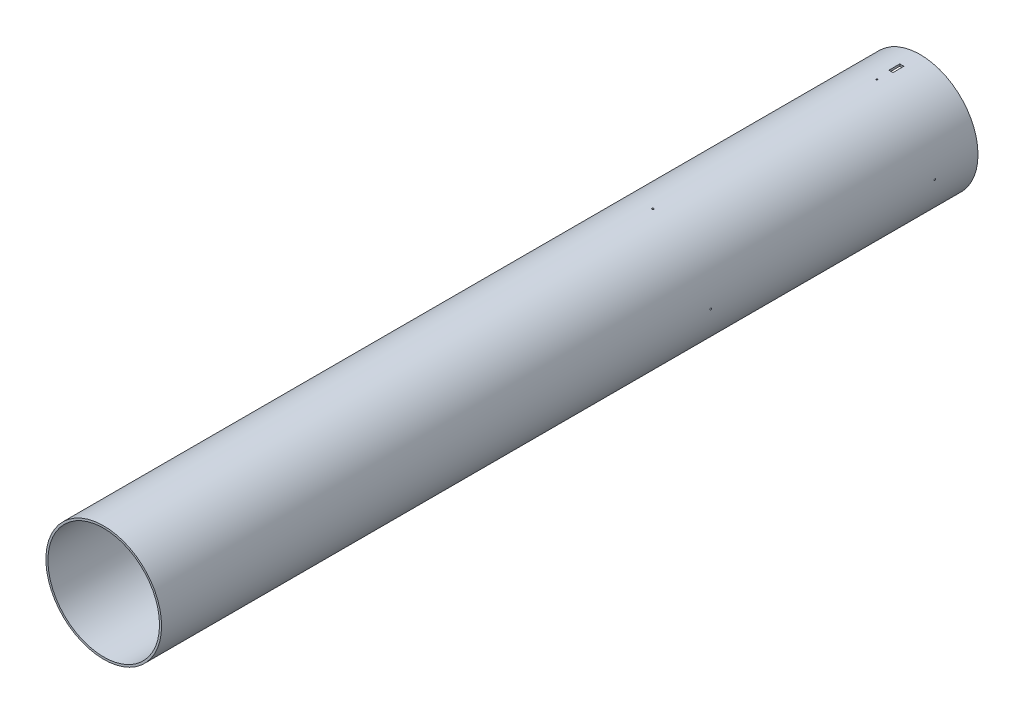
from build123d import *

# Parameters (mm, degrees)
SKETCH1_R           = 85
SKETCH1_R_2         = 82
BOSS_EXTRUDE1_DEPTH = 1200
SKETCH2_R           = 1.25
CUT_EXTRUDE1_DEPTH  = 900
CIRPATTERN1_COUNT   = 4
SKETCH3_W           = 6
SKETCH3_H           = 6
SKETCH3_H_2         = 10
CUT_EXTRUDE2_DEPTH  = 104
CIRPATTERN2_COUNT   = 2
SKETCH5_R           = 1
CUT_EXTRUDE3_DEPTH  = 104
CIRPATTERN3_COUNT   = 4


with BuildPart() as part:
    # Sketch1 → Boss-Extrude1 (new body)
    with BuildSketch(Plane.XY):
        Circle(SKETCH1_R)
        Circle(SKETCH1_R_2, mode=Mode.SUBTRACT)
    extrude(amount=BOSS_EXTRUDE1_DEPTH)

    # Sketch2 → Cut-Extrude1 (cut)
    with BuildSketch(Plane(origin=(0, 0, 0), x_dir=(1, 0, 0), z_dir=(0, 1, 0))):
        with Locations(Location((0, -393, 0), (0, 0, 270))):
            Circle(SKETCH2_R)
    cut_extrude1 = extrude(amount=-CUT_EXTRUDE1_DEPTH, mode=Mode.SUBTRACT)

    # CirPattern1: Cut-Extrude1 ×4 about axis
    cirpattern1_axis = Axis((0, 0, 0), (0, 0, 1))
    for i in range(1, CIRPATTERN1_COUNT):
        add(cut_extrude1.rotate(cirpattern1_axis, i * 360 / CIRPATTERN1_COUNT), mode=Mode.SUBTRACT)

    # Sketch3 → Cut-Extrude2 (cut)
    with BuildSketch(Plane(origin=(0, 0, 0), x_dir=(1, 0, 0), z_dir=(0, 1, 0))):
        with Locations((0, -30)):
            Rectangle(SKETCH3_W, SKETCH3_H)
        with Locations((0, -38)):
            Rectangle(SKETCH3_W, SKETCH3_H_2)
    cut_extrude2 = extrude(amount=-CUT_EXTRUDE2_DEPTH, mode=Mode.SUBTRACT)

    # CirPattern2: Cut-Extrude2 ×2 about axis
    cirpattern2_axis = Axis((0, 0, 0), (0, 0, 1))
    for i in range(1, CIRPATTERN2_COUNT):
        add(cut_extrude2.rotate(cirpattern2_axis, i * 360 / CIRPATTERN2_COUNT), mode=Mode.SUBTRACT)

    # Sketch5 → Cut-Extrude3 (cut)
    with BuildSketch(Plane(origin=(0, 0, 0), x_dir=(1, 0, 0), z_dir=(0, 1, 0))):
        with Locations(Location((0, -63.5, 0), (0, 0, 270))):
            Circle(SKETCH5_R)
    cut_extrude3 = extrude(amount=-CUT_EXTRUDE3_DEPTH, mode=Mode.SUBTRACT)

    # CirPattern3: Cut-Extrude3 ×4 about axis
    cirpattern3_axis = Axis((0, 0, 0), (0, 0, 1))
    for i in range(1, CIRPATTERN3_COUNT):
        add(cut_extrude3.rotate(cirpattern3_axis, i * 360 / CIRPATTERN3_COUNT), mode=Mode.SUBTRACT)


solid = part.part
